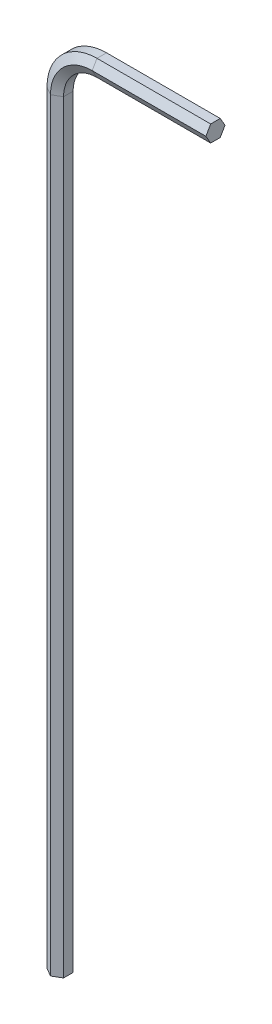
from build123d import *


with BuildPart() as part:
    # Sweep1: sweep along a path in Sketch1
    with BuildLine(Plane.XY) as sweep1_path:
        Line((0, 0), (0, 73.20625))
        ThreePointArc((0, 73.20625), (1.171572875, 76.034677125), (4, 77.20625))
        Line((4, 77.20625), (14.90625, 77.20625))
    # Sketch2 → Sweep1 (sweep)
    with BuildSketch(Plane(origin=(0, 0, 0), x_dir=(1, 0, 0), z_dir=(0, 1, 0))):
        Polygon((0, 0.916543552), (-0.79375, 0.458271776), (-0.79375, -0.458271776), (0, -0.916543552), (0.79375, -0.458271776), (0.79375, 0.458271776), align=None)
    sweep(path=sweep1_path.line)


solid = part.part
